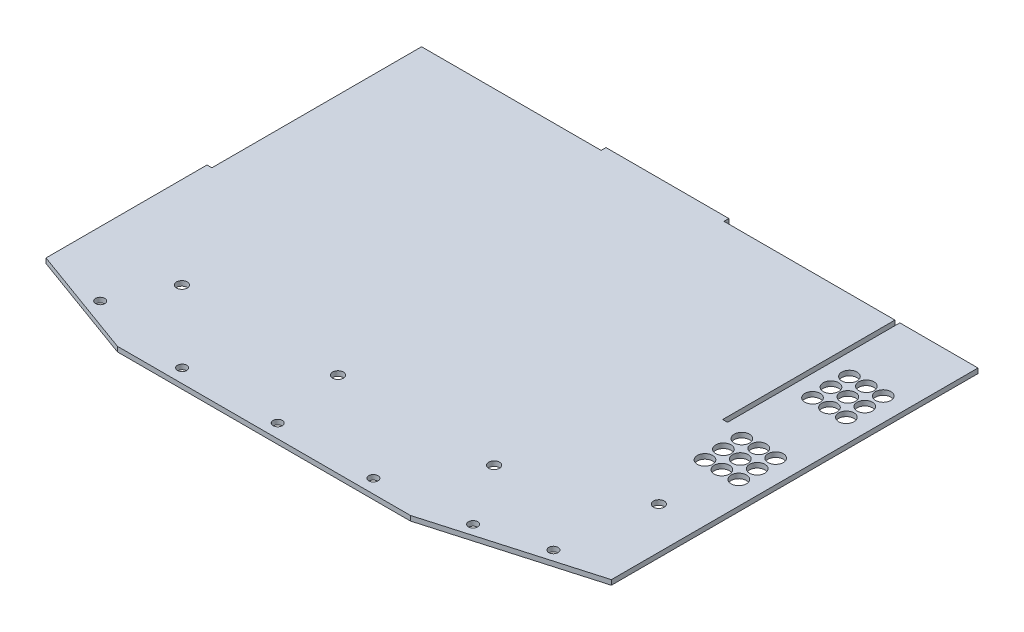
from build123d import *

# Parameters (mm, degrees)
SKETCH1_W               = 308.1112
SKETCH1_H               = 3.175
BOSS_EXTRUDE1_DEPTH     = 267.83
SKETCH3_W               = 155.702
SKETCH3_H               = 3.175
BOSS_EXTRUDE3_DEPTH     = 3.175
SKETCH4_W               = 50.87366
SKETCH4_H               = 3.175
BOSS_EXTRUDE4_DEPTH     = 267.83
CUT_EXTRUDE1_DEPTH      = 340.190761306
CUT_EXTRUDE3_DEPTH      = 340.190761306
SKETCH13_R              = 5
CUT_EXTRUDE4_DEPTH      = 340.190761306
LPATTERN1_COUNT         = 3
LPATTERN1_PITCH         = 12
SKETCH17_W              = 105.930619964
SKETCH17_H              = 3.175
BOSS_EXTRUDE5_DEPTH     = 3.175
SKETCH18_W              = 80
SKETCH18_H              = 3.175
BOSS_EXTRUDE6_DEPTH     = 3.175
CUT_EXTRUDE7_DEPTH      = 340.190761306
CUT_EXTRUDE7_DEPTH_BACK = 340.190761306
SKETCH25_R              = 3
CUT_EXTRUDE8_DEPTH      = 3.175
M6_CLEARANCE_HOLE1_D    = 7
M6_CLEARANCE_HOLE2_D    = 7


with BuildPart() as part:
    # Sketch1 → Boss-Extrude1 (new body)
    with BuildSketch(Plane.XY):
        Rectangle(SKETCH1_W, SKETCH1_H)
    extrude(amount=BOSS_EXTRUDE1_DEPTH)

    # Sketch3 → Boss-Extrude3 (add)
    with BuildSketch(Plane(origin=(154.0556, 0, 0), x_dir=(0, 0, -1), z_dir=(1, 0, 0))):
        with Locations((-189.979, 0)):
            Rectangle(SKETCH3_W, SKETCH3_H)
    extrude(amount=BOSS_EXTRUDE3_DEPTH)

    # Sketch4 → Boss-Extrude4 (add)
    with BuildSketch(Plane.XY.offset(267.83)):
        with Locations((182.66743, 0)):
            Rectangle(SKETCH4_W, SKETCH4_H)
    extrude(amount=-BOSS_EXTRUDE4_DEPTH)

    # Sketch6 → Cut-Extrude1 (cut, through all)
    with BuildSketch(Plane(origin=(0, 1.5875, 0), x_dir=(1, 0, 0), z_dir=(0, 1, 0))):
        Polygon((208.10426, -238.620139294), (106.50426, -267.83), (208.10426, -267.83), align=None)
    extrude(amount=-CUT_EXTRUDE1_DEPTH, mode=Mode.SUBTRACT)

    # Sketch11 → Cut-Extrude3 (cut, through all)
    with BuildSketch(Plane.XZ.offset(1.5875)):
        Polygon((-154.0556, 242.43), (-84.2056, 267.83), (-154.0556, 267.83), align=None)
    extrude(amount=-CUT_EXTRUDE3_DEPTH, mode=Mode.SUBTRACT)

    # Sketch13 → Cut-Extrude4 (cut, through all)
    with BuildSketch(Plane.XZ.offset(1.5875)):
        with Locations(Location((171.04991, 116.644763656, 0), (0, 0, 270))):
            Circle(SKETCH13_R)
        with Locations(Location((182.04991, 116.644763656, 0), (0, 0, 270))):
            Circle(SKETCH13_R)
        with Locations(Location((193.04991, 116.644763656, 0), (0, 0, 270))):
            Circle(SKETCH13_R)
        with Locations(Location((171.04991, 46.644823778, 0), (0, 0, 270))):
            Circle(SKETCH13_R)
        with Locations(Location((182.04991, 46.644823778, 0), (0, 0, 270))):
            Circle(SKETCH13_R)
        with Locations(Location((193.04991, 46.644823778, 0), (0, 0, 270))):
            Circle(SKETCH13_R)
    cut_extrude4 = extrude(amount=-CUT_EXTRUDE4_DEPTH, mode=Mode.SUBTRACT)

    # LPattern1: Cut-Extrude4 ×3
    with Locations(*[(0, 0, i * LPATTERN1_PITCH) for i in range(1, LPATTERN1_COUNT)]):
        add(cut_extrude4, mode=Mode.SUBTRACT)

    # Sketch17 → Boss-Extrude5 (add)
    with BuildSketch(Plane.ZY.offset(154.0556)):
        with Locations((189.464690018, 0)):
            Rectangle(SKETCH17_W, SKETCH17_H)
    extrude(amount=BOSS_EXTRUDE5_DEPTH)

    # Sketch18 → Boss-Extrude6 (add)
    with BuildSketch(Plane(origin=(0, 0, 0), x_dir=(-1, 0, 0), z_dir=(0, 0, -1))):
        with Locations((-2.78399998, 0)):
            Rectangle(SKETCH18_W, SKETCH18_H)
    extrude(amount=BOSS_EXTRUDE6_DEPTH)

    # Sketch23 → Cut-Extrude7 (cut, two sides: drawn at the far end of the back side and taken through both)
    with BuildSketch(Plane(origin=(0, 1.5875, 0), x_dir=(1, 0, 0), z_dir=(0, 1, 0)).offset(-CUT_EXTRUDE7_DEPTH_BACK)):
        Polygon((681.560448342, -546.290381215), (-154.0556, -242.43), (-157.2306, -241.275454545), (-992.846648342, 62.58492667), (-1600.567410773, -1608.647170014), (73.839685911, -2217.5224779), align=None)
    extrude(amount=CUT_EXTRUDE7_DEPTH + CUT_EXTRUDE7_DEPTH_BACK, mode=Mode.SUBTRACT)

    # Sketch25 → Cut-Extrude8 (cut)
    with BuildSketch(Plane.XZ.offset(1.5875)):
        with Locations(Location((-115.3206, 247.915394364, 0), (0, 0, 270))):
            Circle(SKETCH25_R)
        with Locations(Location((-50.97574, 258.94, 0), (0, 0, 270))):
            Circle(SKETCH25_R)
        with Locations(Location((11.25426, 258.94, 0), (0, 0, 270))):
            Circle(SKETCH25_R)
        with Locations(Location((73.48426, 258.94, 0), (0, 0, 270))):
            Circle(SKETCH25_R)
        with Locations(Location((172.54426, 240.761310541, 0), (0, 0, 270))):
            Circle(SKETCH25_R)
        with Locations(Location((131.90426, 252.445254824, 0), (0, 0, 270))):
            Circle(SKETCH25_R)
    extrude(amount=-CUT_EXTRUDE8_DEPTH, mode=Mode.SUBTRACT)

    # M6 Clearance Hole1 (through all)
    with Locations(Plane.XZ.offset(1.5875)):
        with Locations((180.96500002, 180.586)):
            Hole(M6_CLEARANCE_HOLE1_D / 2)

    # M6 Clearance Hole2 (through all)
    with Locations(Plane(origin=(0, -1.5875, 0), x_dir=(-1, 0, 0), z_dir=(0, -1, 0))):
        with Locations((97.77095, -212.2849914), (-3.82905, -212.2849914), (-105.42905, -212.2849914)):
            Hole(M6_CLEARANCE_HOLE2_D / 2)


solid = part.part
